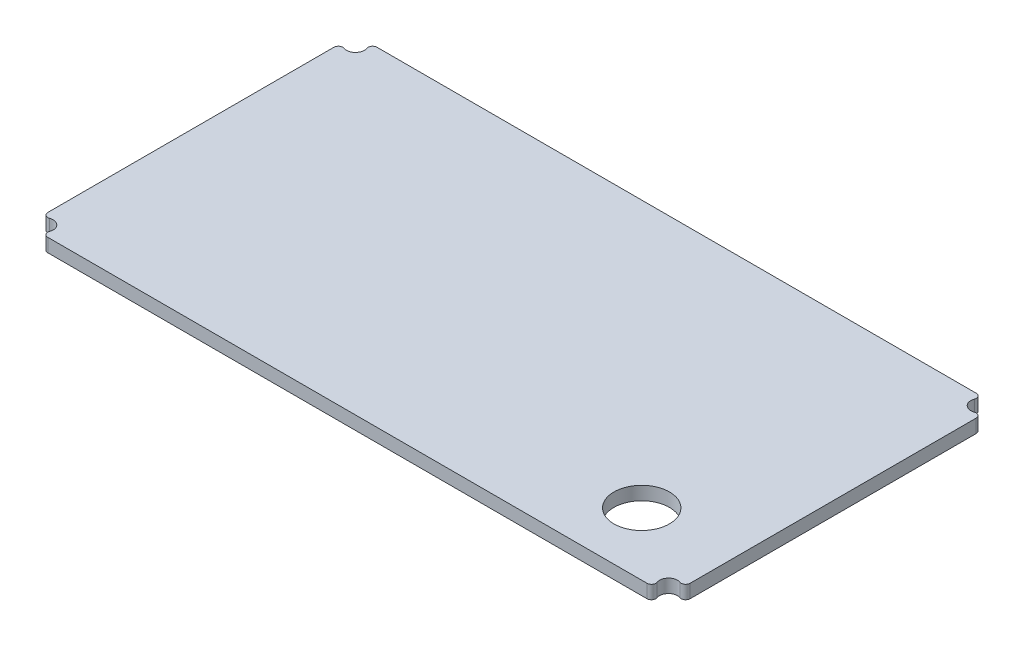
from build123d import *

# Parameters (mm, degrees)
BOSS_EXTRUDE1_DEPTH = 1.5
SKETCH2_R           = 3.1
CUT_EXTRUDE1_DEPTH  = 1.5


with BuildPart() as part:
    # Sketch1 → Boss-Extrude1 (new body)
    with BuildSketch(Plane(origin=(0, 0, 0), x_dir=(1, 0, 0), z_dir=(0, 1, 0))):
        with BuildLine():
            Line((2.414213562, 0), (69.385786438, 0))
            ThreePointArc((69.385786438, 0), (69.794034728, 0.211324865), (69.857190958, 0.666666667))
            ThreePointArc((69.857190958, 0.666666667), (70.092893219, 1.707106781), (71.133333333, 1.942809042))
            ThreePointArc((71.133333333, 1.942809042), (71.588675135, 2.005965272), (71.8, 2.414213562))
            Line((71.8, 2.414213562), (71.8, 34.385786438))
            ThreePointArc((71.8, 34.385786438), (71.588675135, 34.794034728), (71.133333333, 34.857190958))
            ThreePointArc((71.133333333, 34.857190958), (70.092893219, 35.092893219), (69.857190958, 36.133333333))
            ThreePointArc((69.857190958, 36.133333333), (69.794034728, 36.588675135), (69.385786438, 36.8))
            Line((69.385786438, 36.8), (2.414213562, 36.8))
            ThreePointArc((2.414213562, 36.8), (2.005965272, 36.588675135), (1.942809042, 36.133333333))
            ThreePointArc((1.942809042, 36.133333333), (1.707106781, 35.092893219), (0.666666667, 34.857190958))
            ThreePointArc((0.666666667, 34.857190958), (0.211324865, 34.794034728), (0, 34.385786438))
            Line((0, 34.385786438), (0, 2.414213562))
            ThreePointArc((0, 2.414213562), (0.211324865, 2.005965272), (0.666666667, 1.942809042))
            ThreePointArc((0.666666667, 1.942809042), (1.707106781, 1.707106781), (1.942809042, 0.666666667))
            ThreePointArc((1.942809042, 0.666666667), (2.005965272, 0.211324865), (2.414213562, 0))
        make_face()
    extrude(amount=BOSS_EXTRUDE1_DEPTH)

    # Sketch2 → Cut-Extrude1 (cut)
    with BuildSketch(Plane(origin=(0, 1.5, 0), x_dir=(1, 0, 0), z_dir=(0, 1, 0))):
        with Locations(Location((61.8, 7, 0), (0, 0, 270))):
            Circle(SKETCH2_R)
    extrude(amount=-CUT_EXTRUDE1_DEPTH, mode=Mode.SUBTRACT)


solid = part.part
